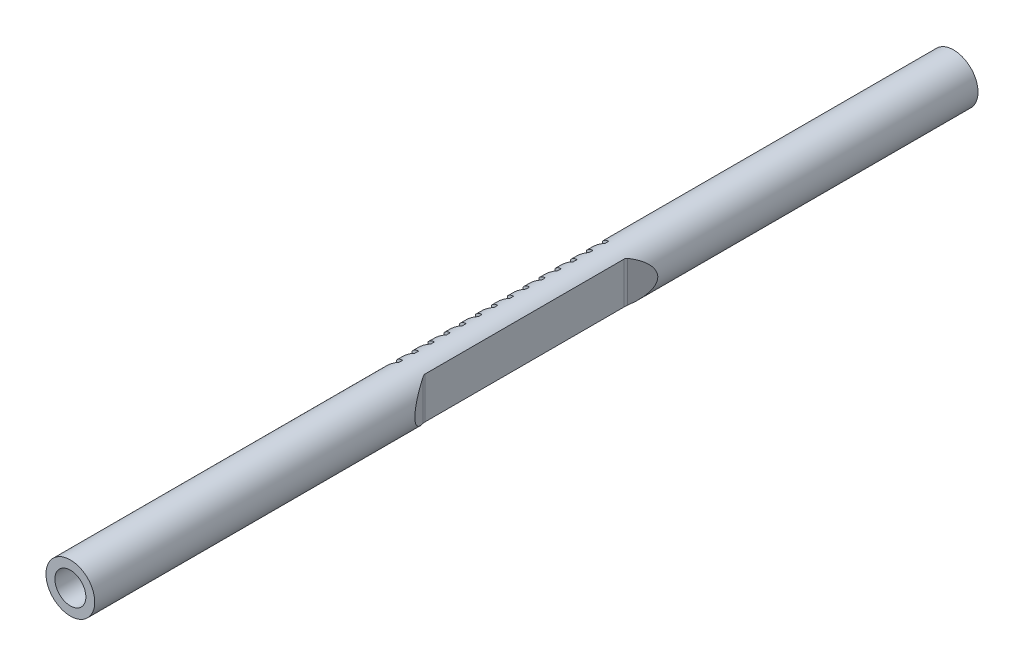
from build123d import *

# Parameters (mm, degrees)
SKETCH1_R               = 10.3025
BOSS_EXTRUDE1_DEPTH     = 390
SKETCH2_R               = 6.5485
CUT_EXTRUDE1_DEPTH      = 141.75
CUT_EXTRUDE2_START      = -141.75
SKETCH3_R               = 6.5485
CUT_EXTRUDE2_DEPTH      = 141.75
CUT_EXTRUDE3_DEPTH      = 20
CUT_EXTRUDE3_DEPTH_BACK = 20
SKETCH4_W               = 2.8
SKETCH4_H               = 97.6
CUT_EXTRUDE4_DEPTH      = 20
LPATTERN1_COUNT         = 14
LPATTERN1_PITCH         = 6.7
SKETCH6_W               = 24.776384874
SKETCH6_H               = 25.11648024
CUT_EXTRUDE5_DEPTH      = 8.25
SKETCH7_W               = 32.905320966
SKETCH7_H               = 32.372251486
CUT_EXTRUDE6_DEPTH      = 8.25
FILLET2_R               = 2.38


with BuildPart() as part:
    # Sketch1 → Boss-Extrude1 (new body)
    with BuildSketch(Plane.XY):
        Circle(SKETCH1_R)
    extrude(amount=BOSS_EXTRUDE1_DEPTH)

    # Sketch2 → Cut-Extrude1 (cut)
    with BuildSketch(Plane(origin=(0, 0, 0), x_dir=(-1, 0, 0), z_dir=(0, 0, -1))):
        Circle(SKETCH2_R)
    extrude(amount=-CUT_EXTRUDE1_DEPTH, mode=Mode.SUBTRACT)

    # Sketch3 → Cut-Extrude2 (cut)
    with BuildSketch(Plane.XY.offset(390).offset(CUT_EXTRUDE2_START)):
        Circle(SKETCH3_R)
    extrude(amount=CUT_EXTRUDE2_DEPTH, mode=Mode.SUBTRACT)

    # Sketch4 → Cut-Extrude3 (cut, two sides: drawn at the far end of the back side and taken through both)
    with BuildSketch(Plane(origin=(0, 0, 0), x_dir=(1, 0, 0), z_dir=(0, 1, 0)).offset(-CUT_EXTRUDE3_DEPTH_BACK)):
        with Locations((-9.0275, -195.025)):
            Rectangle(SKETCH4_W, SKETCH4_H)
        Polygon((10.438224829, -246.605018761), (10.438224829, -143.415160631), (5.396274252, -152.308643269), (5.396274252, -237.711536124), align=None)
    extrude(amount=CUT_EXTRUDE3_DEPTH + CUT_EXTRUDE3_DEPTH_BACK, mode=Mode.SUBTRACT)

    # Sketch5 → Cut-Extrude4 (cut, symmetric)
    with BuildSketch(Plane(origin=(0, 0, 0), x_dir=(1, 0, 0), z_dir=(0, 1, 0))):
        Polygon((-3.4275, -152.275), (-3.4275, -150.675), (-7.6275, -149.175), (-7.6275, -153.775), align=None)
    cut_extrude4 = extrude(amount=CUT_EXTRUDE4_DEPTH, both=True, mode=Mode.SUBTRACT)

    # LPattern1: Cut-Extrude4 ×14
    with Locations(*[(0, 0, i * LPATTERN1_PITCH) for i in range(1, LPATTERN1_COUNT)]):
        add(cut_extrude4, mode=Mode.SUBTRACT)

    # Sketch6 → Cut-Extrude5 (cut)
    with BuildSketch(Plane.XY.offset(390)):
        Rectangle(SKETCH6_W, SKETCH6_H)
    extrude(amount=-CUT_EXTRUDE5_DEPTH, mode=Mode.SUBTRACT)

    # Sketch7 → Cut-Extrude6 (cut)
    with BuildSketch(Plane(origin=(0, 0, 0), x_dir=(-1, 0, 0), z_dir=(0, 0, -1))):
        Rectangle(SKETCH7_W, SKETCH7_H)
    extrude(amount=-CUT_EXTRUDE6_DEPTH, mode=Mode.SUBTRACT)

    # Fillet2
    fillet2_edges = [part.edges().sort_by_distance(p)[0] for p in [
        (5.396274252, 0, 237.711536124),
        (5.396274252, 0, 152.308643269),
    ]]
    fillet(fillet2_edges, radius=FILLET2_R)


solid = part.part
